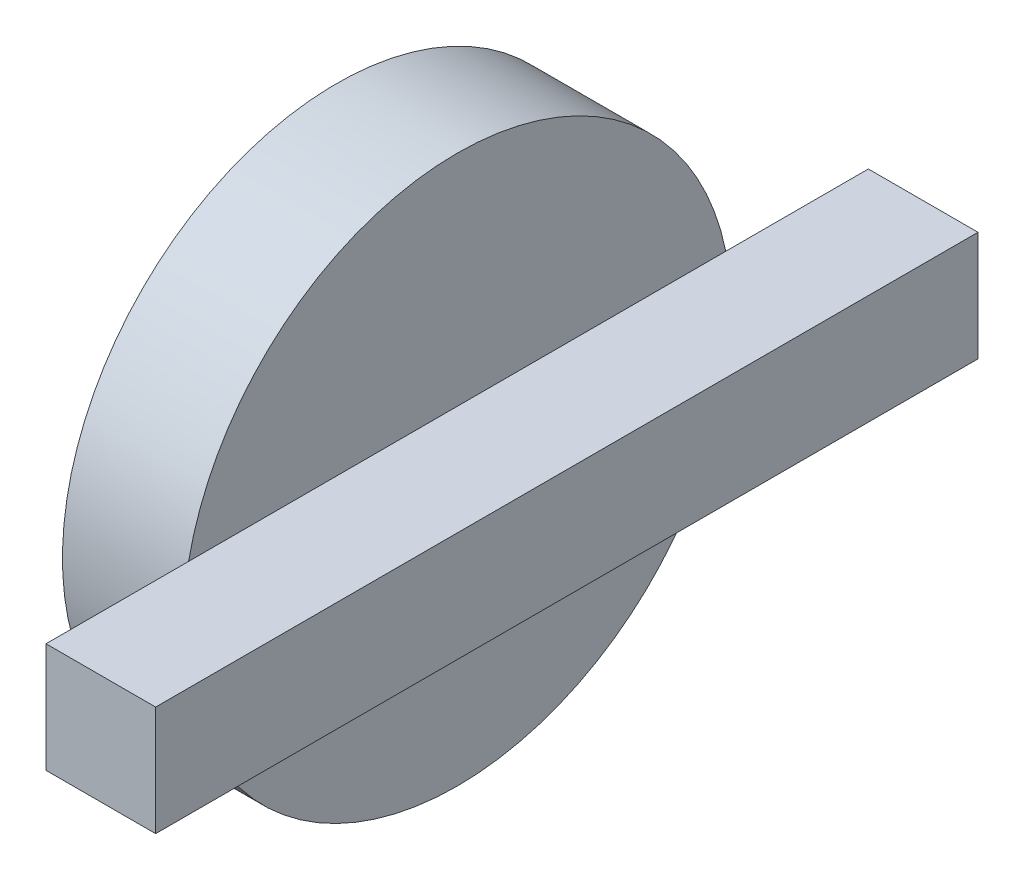
from build123d import *

# Parameters (mm, degrees)
SKETCH1_R           = 50
BOSS_EXTRUDE1_DEPTH = 11
SKETCH2_R           = 30
CUT_EXTRUDE1_DEPTH  = 12
SKETCH3_W           = 150
SKETCH3_H           = 20
BOSS_EXTRUDE2_DEPTH = 20


with BuildPart() as part:
    # Sketch1 → Boss-Extrude1 (new, symmetric)
    with BuildSketch(Plane(origin=(0, 0, 0), x_dir=(0, 0, -1), z_dir=(1, 0, 0))):
        Circle(SKETCH1_R)
    extrude(amount=BOSS_EXTRUDE1_DEPTH, both=True)

    # Sketch2 → Cut-Extrude1 (cut)
    with BuildSketch(Plane.ZY.offset(11)):
        Circle(SKETCH2_R)
    extrude(amount=-CUT_EXTRUDE1_DEPTH, mode=Mode.SUBTRACT)

    # Sketch3 → Boss-Extrude2 (add)
    with BuildSketch(Plane(origin=(11, 0, 0), x_dir=(0, 0, -1), z_dir=(1, 0, 0))):
        Rectangle(SKETCH3_W, SKETCH3_H)
    extrude(amount=BOSS_EXTRUDE2_DEPTH)


solid = part.part
